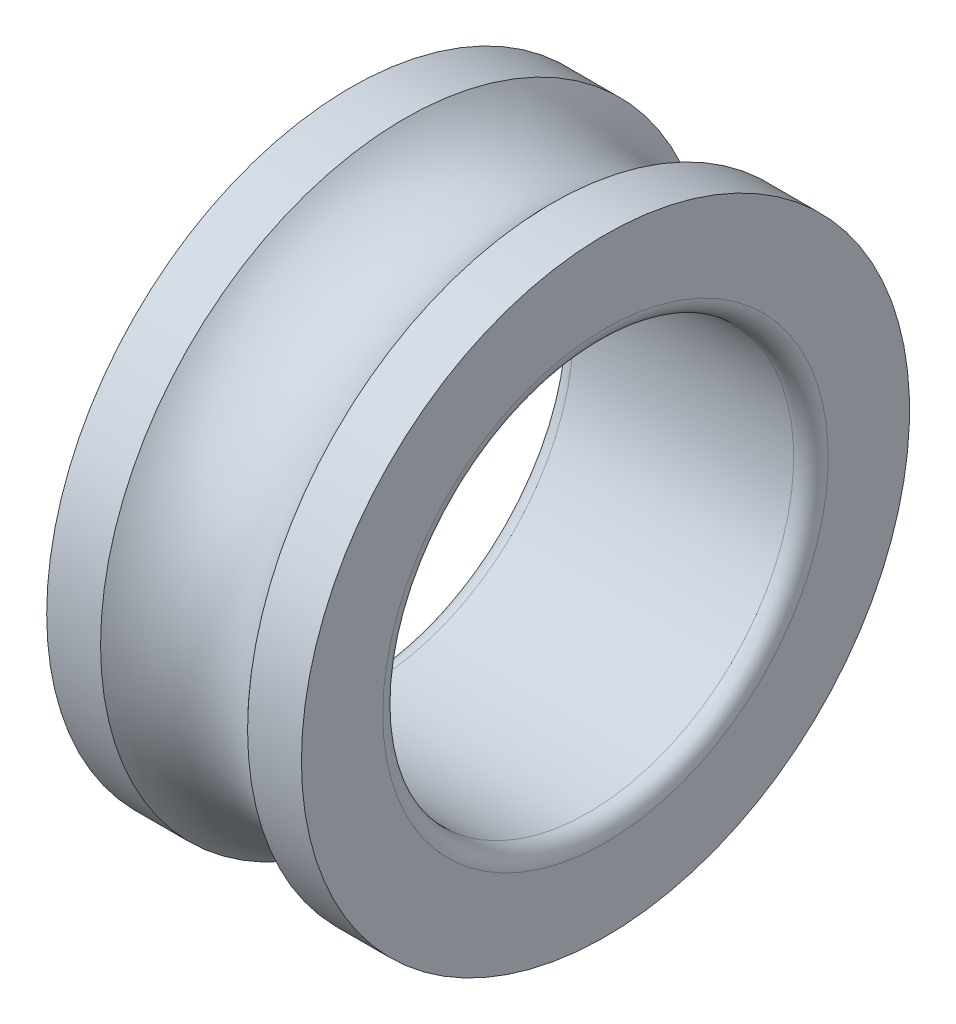
from build123d import *


with BuildPart() as part:
    # Sketch1 → Revolve1 (revolve)
    with BuildSketch(Plane.XY, mode=Mode.PRIVATE) as revolve1_sk:
        with BuildLine():
            Line((4.965934628, 37), (-1.589793462, 37))
            Line((-1.589793462, 37), (-1.589793462, 27.1))
            ThreePointArc((-1.589793462, 27.1), (-0.974717703, 25.61507576), (0.510206538, 25))
            Line((0.510206538, 25), (27.310206538, 25))
            ThreePointArc((27.310206538, 25), (28.795130778, 25.61507576), (29.410206538, 27.1))
            Line((29.410206538, 27.1), (29.410206538, 37))
            Line((29.410206538, 37), (22.854478448, 37))
            ThreePointArc((22.854478448, 37), (13.910206538, 33), (4.965934628, 37))
        make_face()
    revolve(revolve1_sk.sketch.rotate(Axis((-42.904732112, 0, 0), (1, 0, 0)), 90), axis=Axis((-42.904732112, 0, 0), (1, 0, 0)))


solid = part.part
